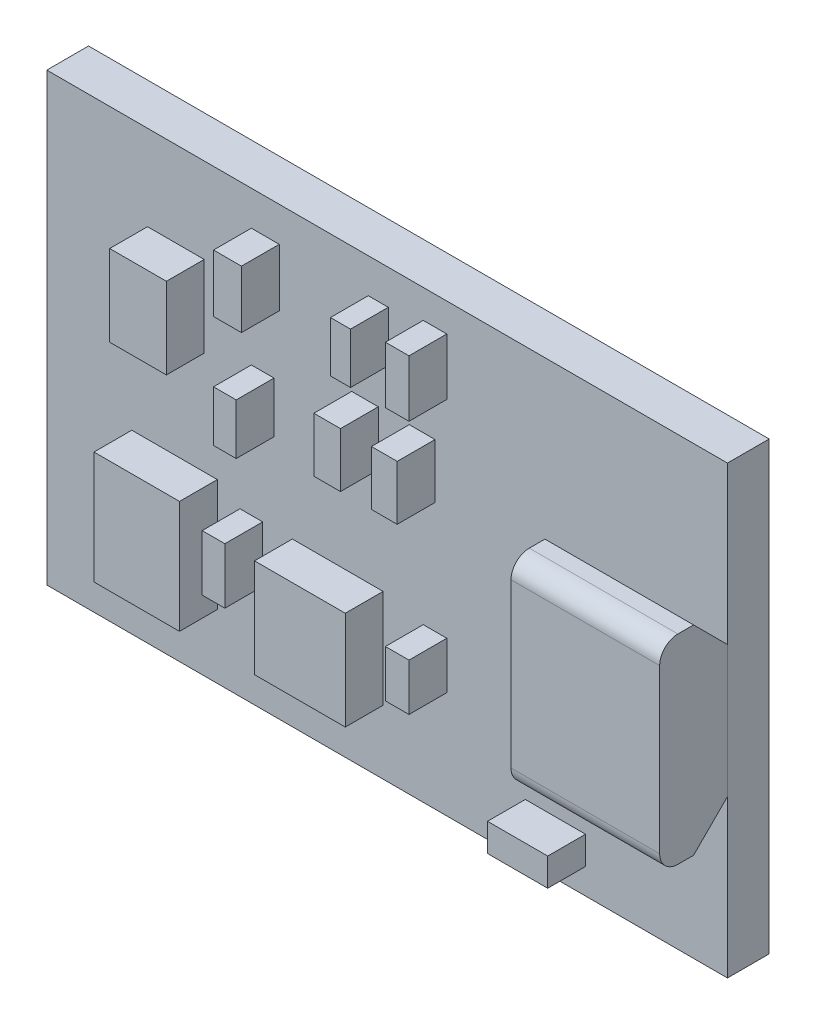
from build123d import *

# Parameters (mm, degrees)
SKETCH_1_W      = 26.1
SKETCH_1_H      = 17.1
EXTRUDE_1_DEPTH = 1.6
EXTRUDE_START   = -1.6
SKETCH_2_W      = 5.7
SKETCH_2_H      = 7.65
EXTRUDE_2_DEPTH = 2.6
SKETCH_2_3_W    = 2.174780603
SKETCH_2_3_H    = 3.11160917
SKETCH_2_3_W_2  = 1.07066122
SKETCH_2_3_H_2  = 2.208238767
SKETCH_2_3_W_3  = 0.769537752
SKETCH_2_3_H_3  = 1.940573462
SKETCH_2_3_W_4  = 0.903370404
SKETCH_2_3_H_4  = 2.174780604
SKETCH_2_3_W_5  = 0.987015812
SKETCH_2_3_H_5  = 2.091135195
SKETCH_2_3_W_6  = 0.869912241
SKETCH_2_3_H_6  = 1.948938002
SKETCH_2_3_W_7  = 3.278899986
SKETCH_2_3_H_7  = 4.316103044
SKETCH_2_3_W_8  = 0.869912242
SKETCH_2_3_H_8  = 2.14132244
SKETCH_2_3_W_9  = 3.479648965
SKETCH_2_3_H_9  = 3.780772434
SKETCH_2_3_H_10 = 1.806740808
SKETCH_2_3_W_10 = 2.308613255
SKETCH_2_3_H_11 = 1.07066122
SKETCH_2_3_W_11 = 1.020473975
EXTRUDE_3_DEPTH = 3.05
CHAMFER_1_SIZE  = 1.3
FILLET_1_R      = 0.7


with BuildPart() as part:
    # Эскиз1 → Бобышка-Вытянуть1 (new body)
    with BuildSketch(Plane.XY):
        with Locations((-350.770289691, 69.965387452)):
            Rectangle(SKETCH_1_W, SKETCH_1_H)
    extrude(amount=EXTRUDE_1_DEPTH)

    # Эскиз2<3> → Бобышка-Вытянуть3 (add)
    with BuildSketch(Plane(origin=(0, 0, 0), x_dir=(-1, 0, 0), z_dir=(0, 0, -1))):
        with Locations((358.871593715, 73.690295836)):
            Rectangle(SKETCH_2_3_W, SKETCH_2_3_H)
        with Locations((355.442131994, 76.0825545)):
            Rectangle(SKETCH_2_3_W_2, SKETCH_2_3_H_2)
        with Locations((351.109299869, 76.216387152)):
            Rectangle(SKETCH_2_3_W_3, SKETCH_2_3_H_3)
        with Locations((348.934519266, 76.333490723)):
            Rectangle(SKETCH_2_3_W_4, SKETCH_2_3_H_4)
        with Locations((349.428027172, 72.644728238)):
            Rectangle(SKETCH_2_3_W_5, SKETCH_2_3_H_5)
        with Locations((355.542506484, 71.670259237)):
            Rectangle(SKETCH_2_3_W_6, SKETCH_2_3_H_6)
        with Locations((358.921780959, 66.02837648)):
            Rectangle(SKETCH_2_3_W_7, SKETCH_2_3_H_7)
        with Locations((355.977462604, 66.580436172)):
            Rectangle(SKETCH_2_3_W_8, SKETCH_2_3_H_8)
        with Locations((352.665104455, 65.760711175)):
            Rectangle(SKETCH_2_3_W_9, SKETCH_2_3_H_9)
        with Locations((348.934519266, 66.413145356)):
            Rectangle(SKETCH_2_3_W_4, SKETCH_2_3_H_10)
        with Locations((344.317292755, 62.933496391)):
            Rectangle(SKETCH_2_3_W_10, SKETCH_2_3_H_11)
        with Locations((351.619536857, 72.644728238)):
            Rectangle(SKETCH_2_3_W_11, SKETCH_2_3_H_5)
    extrude(amount=-EXTRUDE_3_DEPTH)


with BuildPart() as body_2:
    # Эскиз2 → Бобышка-Вытянуть2 (new body)
    with BuildSketch(Plane(origin=(0, 0, 0), x_dir=(-1, 0, 0), z_dir=(0, 0, -1)).offset(EXTRUDE_START)):
        with Locations((340.570289691, 69.965387452)):
            Rectangle(SKETCH_2_W, SKETCH_2_H)
    extrude(amount=-EXTRUDE_2_DEPTH)

    # Фаска1
    chamfer_1_edges = [body_2.edges().sort_by_distance(p)[0] for p in [
        (-340.570289691, 73.790387452, 1.6),
        (-340.570289691, 66.140387452, 1.6),
    ]]
    chamfer(chamfer_1_edges, length=CHAMFER_1_SIZE)

    # Скругление1
    fillet_1_edges = [body_2.edges().sort_by_distance(p)[0] for p in [
        (-340.570289691, 73.790387452, 4.2),
        (-340.570289691, 66.140387452, 4.2),
    ]]
    fillet(fillet_1_edges, radius=FILLET_1_R)


solid = Compound([part.part, body_2.part])
